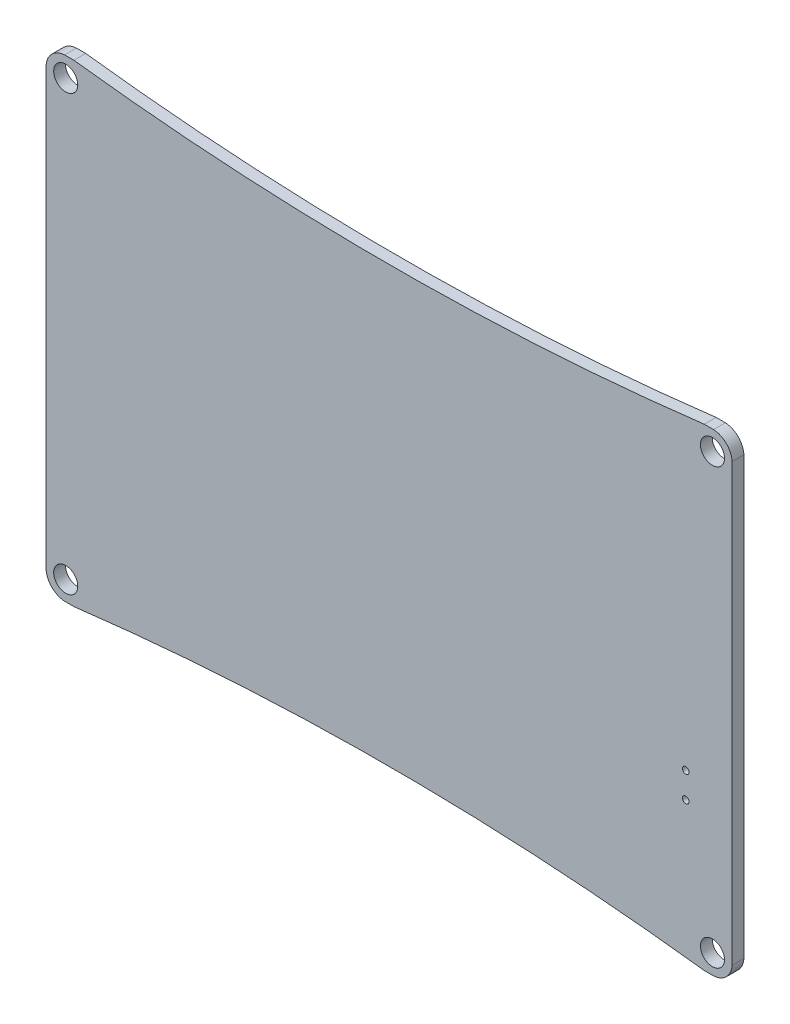
from build123d import *

# Parameters (mm, degrees)
BOARD_OUTLINE_DEPTH = 1.62
SKETCH2_R           = 0.45
NPTH_DEPTH          = 117.618264864
SKETCH3_R           = 1.65
PTH_DEPTH           = 117.618264864


with BuildPart() as part:
    # Sketch1 → Board_Outline (new body)
    with BuildSketch(Plane.XY):
        with BuildLine():
            Line((2.54, 62.89), (2.54, 3.15))
            ThreePointArc((2.54, 3.15), (3.322492676, 1.392492676), (5.08, 0.61))
            Line((5.08, 0.61), (6.35, 0.61))
            ThreePointArc((6.35, 0.61), (49.53, 3.251001938), (92.71, 0.61))
            Line((92.71, 0.61), (93.98, 0.61))
            ThreePointArc((93.98, 0.61), (95.737507324, 1.392492676), (96.52, 3.15))
            Line((96.52, 3.15), (96.52, 62.89))
            ThreePointArc((96.52, 62.89), (95.737507324, 64.647507324), (93.98, 65.43))
            Line((93.98, 65.43), (92.71, 65.43))
            ThreePointArc((92.71, 65.43), (49.53, 62.788998062), (6.35, 65.43))
            Line((6.35, 65.43), (5.08, 65.43))
            ThreePointArc((5.08, 65.43), (3.322492676, 64.647507324), (2.54, 62.89))
        make_face()
    extrude(amount=BOARD_OUTLINE_DEPTH)

    # Sketch2 → NPTH (cut, through all)
    with BuildSketch(Plane.XY):
        with Locations((90.17, 23.09)):
            Circle(SKETCH2_R)
        with Locations((90.17, 19.59)):
            Circle(SKETCH2_R)
    extrude(amount=NPTH_DEPTH, mode=Mode.SUBTRACT)

    # Sketch3 → PTH (cut, through all)
    with BuildSketch(Plane.XY):
        with Locations((93.83, 3.28)):
            Circle(SKETCH3_R)
        with Locations((5.23, 3.28)):
            Circle(SKETCH3_R)
        with Locations((5.23, 62.76)):
            Circle(SKETCH3_R)
        with Locations((93.83, 62.76)):
            Circle(SKETCH3_R)
    extrude(amount=PTH_DEPTH, mode=Mode.SUBTRACT)


solid = part.part
